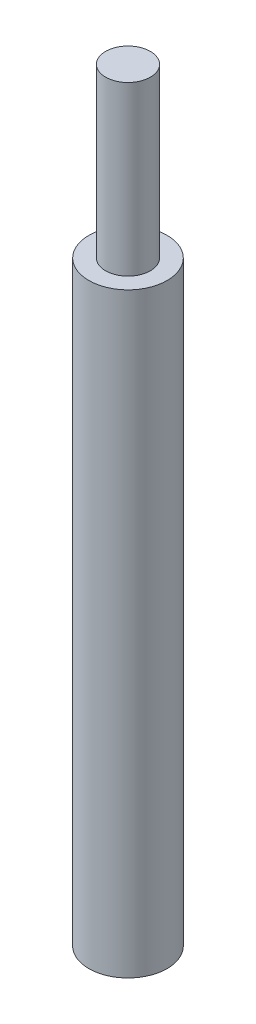
from build123d import *

# Parameters (mm, degrees)
SKETCH1_R           = 3.5
BOSS_EXTRUDE1_DEPTH = 53.3
SKETCH3_R           = 2
BOSS_EXTRUDE2_DEPTH = 15


with BuildPart() as part:
    # Sketch1 → Boss-Extrude1 (new body)
    with BuildSketch(Plane(origin=(0, 0, 0), x_dir=(1, 0, 0), z_dir=(0, 1, 0))):
        with Locations(Location((0, 0, 0), (0, 0, 270))):
            Circle(SKETCH1_R)
    extrude(amount=BOSS_EXTRUDE1_DEPTH)

    # Sketch3 → Boss-Extrude2 (add)
    with BuildSketch(Plane(origin=(0, 53.3, 0), x_dir=(1, 0, 0), z_dir=(0, 1, 0))):
        with Locations(Location((0, 0, 0), (0, 0, 270))):
            Circle(SKETCH3_R)
    extrude(amount=BOSS_EXTRUDE2_DEPTH)


solid = part.part
